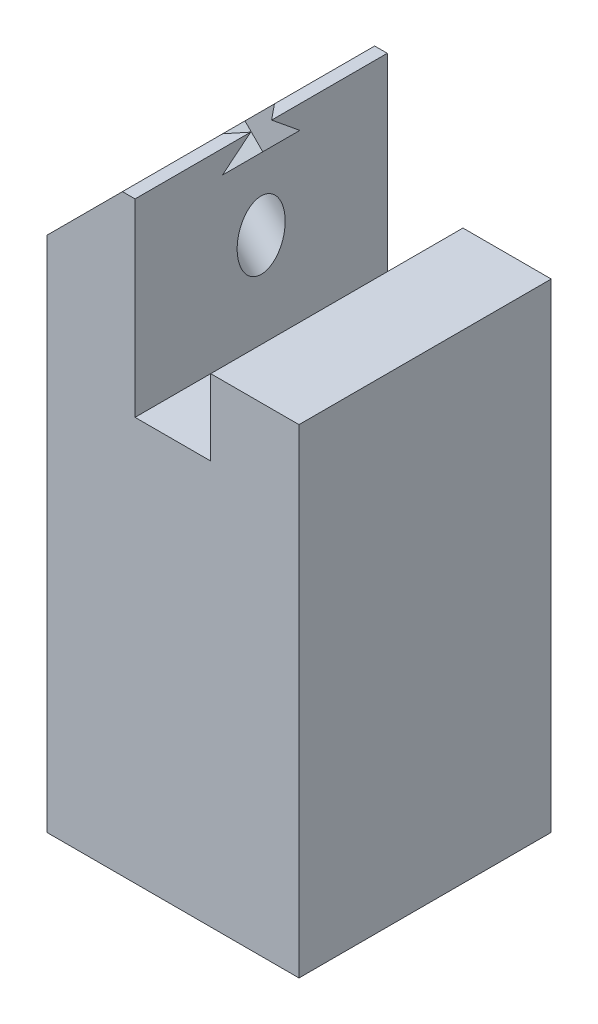
from build123d import *

# Parameters (mm, degrees)
SKETCH1_W           = 20
SKETCH1_H           = 20
BOSS_EXTRUDE1_DEPTH = 6
SKETCH2_W           = 7
SKETCH2_H           = 20
BOSS_EXTRUDE2_DEPTH = 6
SKETCH3_W           = 7
SKETCH3_H           = 20
BOSS_EXTRUDE3_DEPTH = 15
CHAMFER1_SIZE       = 6
SKETCH4_R           = 1.905
CUT_EXTRUDE1_DEPTH  = 10
SKETCH5_W           = 20
SKETCH5_H           = 20
BOSS_EXTRUDE4_DEPTH = 26
CUT_EXTRUDE2_DEPTH  = 2
SKETCH7_R           = 2.75
CUT_EXTRUDE3_DEPTH  = 20
CUT_EXTRUDE4_DEPTH  = 6


with BuildPart() as part:
    # Sketch1 → Boss-Extrude1 (new body)
    with BuildSketch(Plane(origin=(0, 0, 0), x_dir=(1, 0, 0), z_dir=(0, 1, 0))):
        Rectangle(SKETCH1_W, SKETCH1_H)
    extrude(amount=BOSS_EXTRUDE1_DEPTH)

    # Sketch2 → Boss-Extrude2 (add)
    with BuildSketch(Plane(origin=(0, 6, 0), x_dir=(1, 0, 0), z_dir=(0, 1, 0))):
        with Locations((6.5, 0)):
            Rectangle(SKETCH2_W, SKETCH2_H)
    extrude(amount=BOSS_EXTRUDE2_DEPTH)

    # Sketch3 → Boss-Extrude3 (add)
    with BuildSketch(Plane(origin=(0, 6, 0), x_dir=(1, 0, 0), z_dir=(0, 1, 0))):
        with Locations((-6.5, 0)):
            Rectangle(SKETCH3_W, SKETCH3_H)
    extrude(amount=BOSS_EXTRUDE3_DEPTH)

    # Chamfer1
    chamfer1_edges = [part.edges().sort_by_distance(p)[0] for p in [
        (-10, 21, 0),
    ]]
    chamfer(chamfer1_edges, length=CHAMFER1_SIZE)

    # Sketch4 → Cut-Extrude1 (cut)
    with BuildSketch(Plane(origin=(-12.5, 12.5, 0), x_dir=(0, 0, 1), z_dir=(-0.7071067811865489, 0.7071067811865462, 0))):
        with Locations(Location((0, 7.432512212, 0), (0, 0, 270))):
            Circle(SKETCH4_R)
    extrude(amount=-CUT_EXTRUDE1_DEPTH, mode=Mode.SUBTRACT)

    # Sketch5 → Boss-Extrude4 (add)
    with BuildSketch(Plane.XZ):
        Rectangle(SKETCH5_W, SKETCH5_H)
    extrude(amount=BOSS_EXTRUDE4_DEPTH)

    # Sketch6 → Cut-Extrude2 (cut)
    with BuildSketch(Plane(origin=(-12.5, 12.5, 0), x_dir=(0, 0, 1), z_dir=(-0.7071067811865489, 0.7071067811865462, 0))):
        Polygon((0, 13.206014904), (-5, 10.319263558), (-5, 4.545760866), (0, 1.65900952), (5, 4.545760866), (5, 10.319263558), align=None)
    extrude(amount=-CUT_EXTRUDE2_DEPTH, mode=Mode.SUBTRACT)

    # Sketch7 → Cut-Extrude3 (cut)
    with BuildSketch(Plane(origin=(0, -26, 0), x_dir=(-1, 0, 0), z_dir=(0, -1, 0))):
        with Locations(Location((0, 0, 0), (0, 0, 90))):
            Circle(SKETCH7_R)
    extrude(amount=-CUT_EXTRUDE3_DEPTH, mode=Mode.SUBTRACT)

    # Sketch8 → Cut-Extrude4 (cut)
    with BuildSketch(Plane(origin=(0, -26, 0), x_dir=(-1, 0, 0), z_dir=(0, -1, 0))):
        Polygon((5.487604694, -3.196799658), (5.512312062, 3.154005243), (0.024707367, 6.3508049), (-5.487604694, 3.196799658), (-5.512312062, -3.154005243), (-0.024707367, -6.3508049), align=None)
    extrude(amount=-CUT_EXTRUDE4_DEPTH, mode=Mode.SUBTRACT)


solid = part.part
